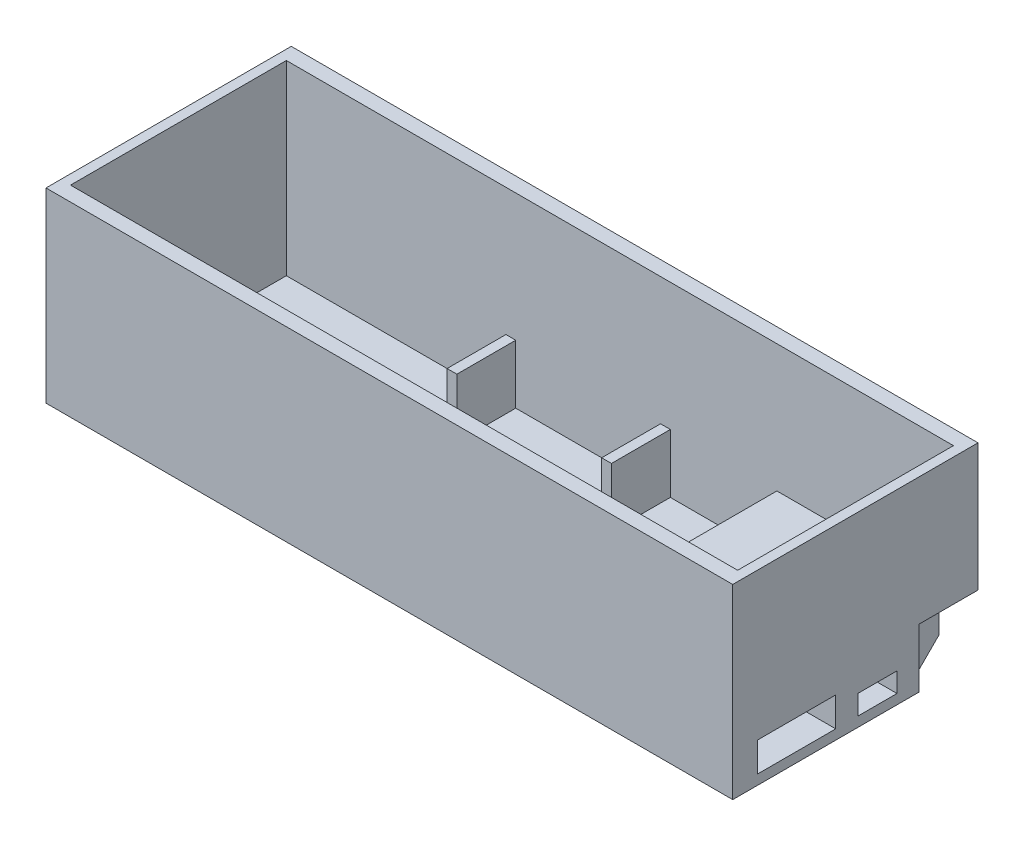
from build123d import *

# Parameters (mm, degrees)
ESQUISSE1_W             = 70
ESQUISSE1_H             = 25
BOSS_EXTRU_1_DEPTH      = 21
ESQUISSE2_W             = 68
ESQUISSE2_H             = 22
ENL_V_MAT_EXTRU_1_DEPTH = 19
ESQUISSE3_W             = 18
ESQUISSE3_H             = 22
ESQUISSE3_W_2           = 1
ESQUISSE3_H_2           = 6
BOSS_EXTRU_2_DEPTH      = 6
ESQUISSE4_W             = 8
ESQUISSE4_H             = 3
ESQUISSE4_W_2           = 4
ESQUISSE4_H_2           = 2
ESQUISSE4_W_3           = 6
ESQUISSE4_H_3           = 8
ENL_V_MAT_EXTRU_2_DEPTH = 4
CHANFREIN1_SIZE         = 2


with BuildPart() as part:
    # Esquisse1 → Boss.-Extru.1 (new body)
    with BuildSketch(Plane(origin=(0, 0, 0), x_dir=(1, 0, 0), z_dir=(0, 1, 0))):
        with Locations((35, 12.5)):
            Rectangle(ESQUISSE1_W, ESQUISSE1_H)
    extrude(amount=BOSS_EXTRU_1_DEPTH)

    # Esquisse2 → Enlèv. mat.-Extru.1 (cut)
    with BuildSketch(Plane(origin=(0, 21, 0), x_dir=(1, 0, 0), z_dir=(0, 1, 0))):
        with Locations((35, 12.5)):
            Rectangle(ESQUISSE2_W, ESQUISSE2_H)
    extrude(amount=-ENL_V_MAT_EXTRU_1_DEPTH, mode=Mode.SUBTRACT)

    # Esquisse3 → Boss.-Extru.2 (add)
    with BuildSketch(Plane(origin=(0, 2, 0), x_dir=(1, 0, 0), z_dir=(0, 1, 0))):
        with Locations((60, 12.5)):
            Rectangle(ESQUISSE3_W, ESQUISSE3_H)
        with Locations((23.881932789, 20.5)):
            Rectangle(ESQUISSE3_W_2, ESQUISSE3_H_2)
        with Locations((39.638895705, 20.5)):
            Rectangle(ESQUISSE3_W_2, ESQUISSE3_H_2)
        with Locations((22.463097558, 4.5)):
            Rectangle(ESQUISSE3_W_2, ESQUISSE3_H_2)
        with Locations((39.638895705, 4.5)):
            Rectangle(ESQUISSE3_W_2, ESQUISSE3_H_2)
    extrude(amount=BOSS_EXTRU_2_DEPTH)

    # Esquisse4 → Enlèv. mat.-Extru.2 (cut)
    with BuildSketch(Plane(origin=(70, 0, 0), x_dir=(0, 0, -1), z_dir=(1, 0, 0))):
        with Locations((6.5, 4.5)):
            Rectangle(ESQUISSE4_W, ESQUISSE4_H)
        with Locations((14.742986582, 4)):
            Rectangle(ESQUISSE4_W_2, ESQUISSE4_H_2)
        with Locations((22, 4)):
            Rectangle(ESQUISSE4_W_3, ESQUISSE4_H_3)
    extrude(amount=-ENL_V_MAT_EXTRU_2_DEPTH, mode=Mode.SUBTRACT)

    # Chanfrein1
    chanfrein1_edges = [part.edges().sort_by_distance(p)[0] for p in [
        (33, 0, -25),
        (70, 0, -9.5),
        (35, 0, 0),
        (0, 0, -12.5),
    ]]
    chamfer(chanfrein1_edges, length=CHANFREIN1_SIZE)


solid = part.part
